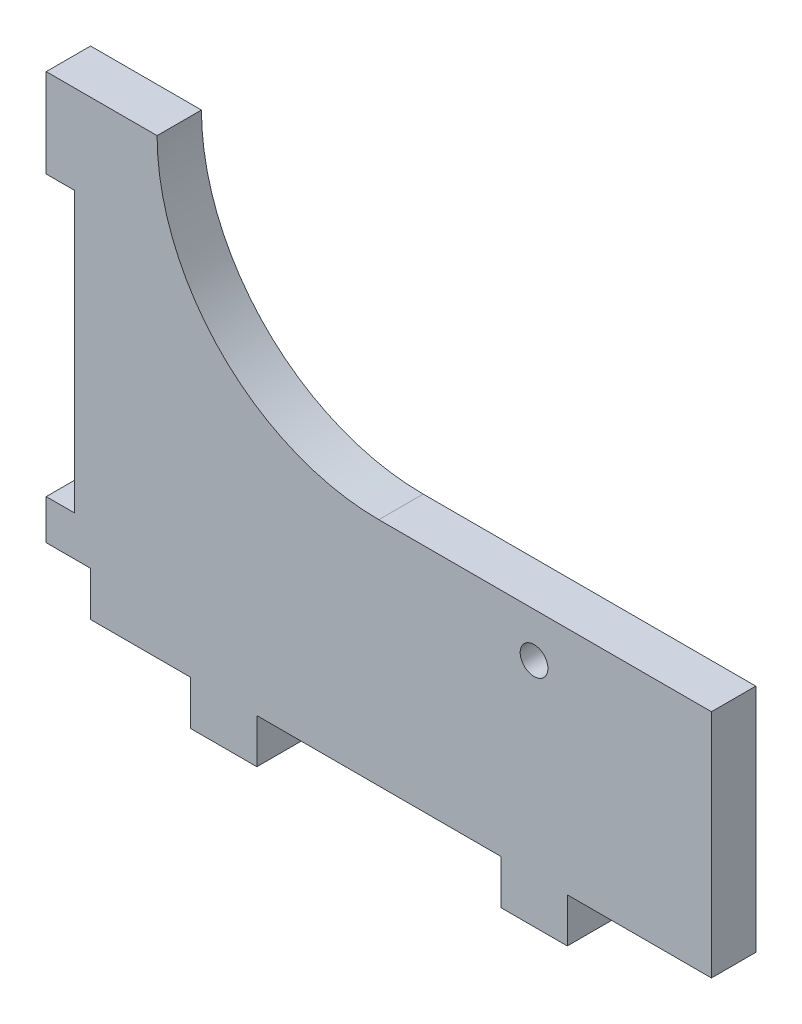
from build123d import *

# Parameters (mm, degrees)
EXTRUDE1_DEPTH        = 12.7
SKETCH2_R             = 3.96875
CUT_EXTRUDE1_DEPTH    = 172.656838198
SKETCH3_W             = 12.7
SKETCH3_H             = 12.7
EXTRUDE2_DEPTH        = 172.656838198
SKETCH4_W             = 105.983052191
SKETCH4_H             = 75.202262717
EXTRUDE3_DEPTH        = 172.656838198
CROQUIS1_W            = 8.075015689
CROQUIS1_H            = 80
CORTAR_EXTRUIR1_DEPTH = 12.7


with BuildPart() as part:
    # Sketch1 → Extrude1 (new body)
    with BuildSketch(Plane.XY):
        with BuildLine():
            Line((-95.25, 12.7), (-53.975, 12.7))
            Line((-53.975, 12.7), (-53.975, 0))
            Line((-53.975, 0), (-34.925, 0))
            Line((-34.925, 0), (-34.925, 12.7))
            Line((-34.925, 12.7), (34.925, 12.7))
            Line((34.925, 12.7), (34.925, 0))
            Line((34.925, 0), (53.975, 0))
            Line((53.975, 0), (53.975, 12.7))
            Line((53.975, 12.7), (95.25, 12.7))
            Line((95.25, 12.7), (95.25, 142.24))
            Line((95.25, 142.24), (63.5, 142.24))
            ThreePointArc((63.5, 142.24), (0, 78.74), (-63.5, 142.24))
            Line((-63.5, 142.24), (-95.25, 142.24))
            Line((-95.25, 142.24), (-95.25, 12.7))
        make_face()
    extrude(amount=EXTRUDE1_DEPTH)

    # Sketch2 → Cut-Extrude1 (cut, through all)
    with BuildSketch(Plane.XY.offset(12.7)):
        with Locations((44.45, 66.04)):
            Circle(SKETCH2_R)
    extrude(amount=-CUT_EXTRUDE1_DEPTH, mode=Mode.SUBTRACT)

    # Sketch3 → Extrude2 (cut, through all)
    with BuildSketch(Plane.XY.offset(12.7)):
        with Locations((-88.9, 19.05)):
            Rectangle(SKETCH3_W, SKETCH3_H)
    extrude(amount=-EXTRUDE2_DEPTH, mode=Mode.SUBTRACT)

    # Sketch4 → Extrude3 (cut, through all)
    with BuildSketch(Plane.XY.offset(12.7)):
        with Locations((52.991526096, 116.341131359)):
            Rectangle(SKETCH4_W, SKETCH4_H)
    extrude(amount=-EXTRUDE3_DEPTH, mode=Mode.SUBTRACT)

    # Croquis1 → Cortar-Extruir1 (cut)
    with BuildSketch(Plane.XY.offset(12.7)):
        with Locations((-91.212492156, 76.84)):
            Rectangle(CROQUIS1_W, CROQUIS1_H)
    extrude(amount=-CORTAR_EXTRUIR1_DEPTH, mode=Mode.SUBTRACT)


solid = part.part
